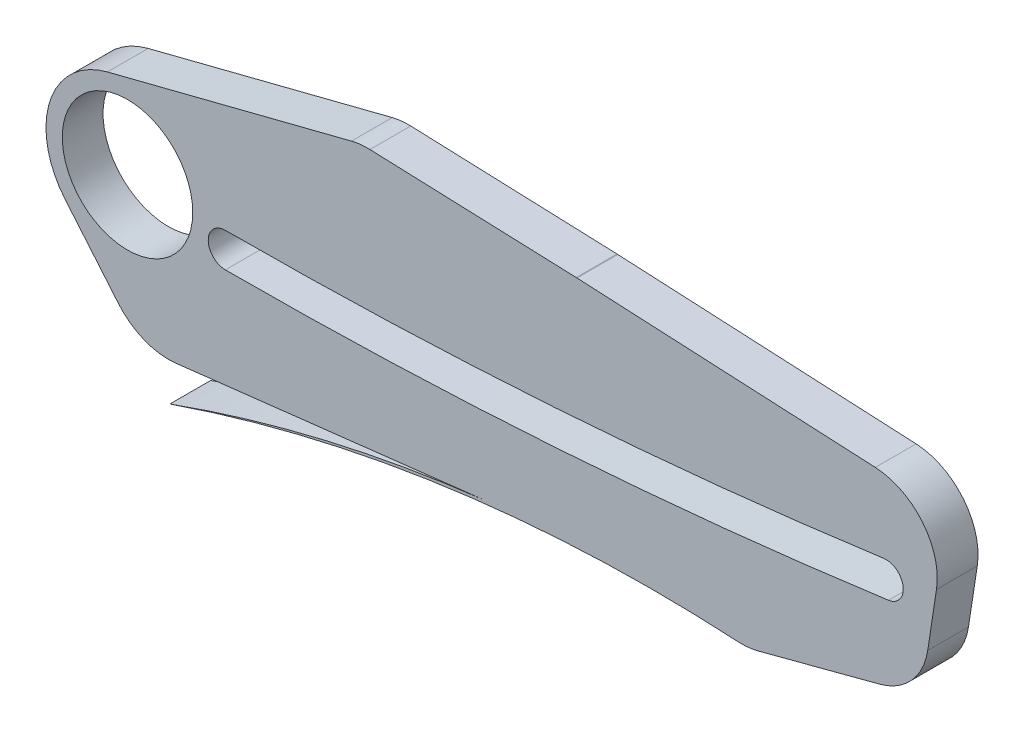
from build123d import *

# Parameters (mm, degrees)
SKETCH_1_R          = 4
EXTRUDE_1_DEPTH     = 1.25
CUT_EXTRUDE_1_DEPTH = 22
EXTRUDE_START       = -2.5
EXTRUDE_2_DEPTH     = 2.5
CUT_EXTRUDE_START   = -2.5
CUT_EXTRUDE_2_DEPTH = 2.5
CUT_EXTRUDE_4_DEPTH = 10
FILLET_1_R          = 4


with BuildPart() as part:
    # 草图1 → 凸台-拉伸1 (new, symmetric)
    with BuildSketch(Plane.XY):
        with BuildLine():
            Line((-1.233702436, 4.84540796), (14.292269552, 8.798517714))
            Line((14.292269552, 8.798517714), (27.541816671, 8.302545362))
            Line((27.541816671, 8.302545362), (50.285691672, 7.168894271))
            Line((50.285691672, 7.168894271), (48.971743891, -1.387225717))
            Line((48.971743891, -1.387225717), (38.114277377, -2.724152564))
            Line((38.114277377, -2.724152564), (18.384478153, -4.790312237))
            Line((18.384478153, -4.790312237), (3.124153733, -7.364758207))
            Line((3.124153733, -7.364758207), (-2.372822781, -4.401103504))
            ThreePointArc((-2.372822781, -4.401103504), (-4.962484216, 0.611351292), (-1.233702436, 4.84540796))
        make_face()
        Circle(SKETCH_1_R, mode=Mode.SUBTRACT)
    extrude(amount=EXTRUDE_1_DEPTH, both=True)

    # 草图2 → 切除-拉伸1 (cut)
    with BuildSketch(Plane.XY.offset(1.25)):
        with BuildLine():
            ThreePointArc((6, -2.05), (26.381158068, -1.352479883), (46.666940766, 0.736816365))
            ThreePointArc((46.666940766, 0.736816365), (47.563889378, 1.920236488), (46.380469254, 2.8171851))
            ThreePointArc((46.380469254, 2.8171851), (26.237586384, 0.742606553), (6, 0.05))
            ThreePointArc((6, 0.05), (4.95, -1), (6, -2.05))
        make_face()
    extrude(amount=-CUT_EXTRUDE_1_DEPTH, mode=Mode.SUBTRACT)

    # 草图3 → 凸台-拉伸2 (add)
    with BuildSketch(Plane(origin=(0, 0, -1.25), x_dir=(-1, 0, 0), z_dir=(0, 0, -1)).offset(EXTRUDE_START)):
        with BuildLine():
            Line((3.830222216, -3.213938048), (-2.597653881, -10.87438248))
            ThreePointArc((-2.597653881, -10.87438248), (-25.103045153, -6.203517484), (-48.061011216, -7.317703438))
            Line((-48.061011216, -7.317703438), (-48.971743891, -1.387225717))
            Line((-48.971743891, -1.387225717), (-38.114277377, -2.724152564))
            Line((-38.114277377, -2.724152564), (-18.384478153, -4.790312237))
            Line((-18.384478153, -4.790312237), (-3.124153733, -7.364758207))
            Line((-3.124153733, -7.364758207), (2.372822781, -4.401103504))
            ThreePointArc((2.372822781, -4.401103504), (3.157812892, -3.876624529), (3.830222216, -3.213938048))
        make_face()
    extrude(amount=EXTRUDE_2_DEPTH)

    # 草图4 → 切除-拉伸2 (cut)
    with BuildSketch(Plane(origin=(0, 0, -1.25), x_dir=(-1, 0, 0), z_dir=(0, 0, -1)).offset(CUT_EXTRUDE_START)):
        with BuildLine():
            Line((-48.675283939, -3.317703438), (-38.061011216, -6.114773366))
            ThreePointArc((-38.061011216, -6.114773366), (-43.07765861, -6.577848026), (-48.061011216, -7.317703438))
            Line((-48.061011216, -7.317703438), (-48.675283939, -3.317703438))
        make_face()
    extrude(amount=CUT_EXTRUDE_2_DEPTH, mode=Mode.SUBTRACT)

    # 草图6 → 切除-拉伸4 (cut)
    with BuildSketch(Plane(origin=(0, 0, -1.25), x_dir=(-1, 0, 0), z_dir=(0, 0, -1))):
        with BuildLine():
            ThreePointArc((-21.916565225, -6.331777176), (-20.02762746, -6.571548728), (-18.144467787, -6.853126294))
            ThreePointArc((-18.144467787, -6.853126294), (-10.276894061, -8.499690713), (-2.597653881, -10.87438248))
            Line((-2.597653881, -10.87438248), (-0.832664521, -8.770950068))
            Line((-0.832664521, -8.770950068), (-21.916565225, -6.331777176))
        make_face()
    extrude(amount=-CUT_EXTRUDE_4_DEPTH, mode=Mode.SUBTRACT)

    # 圆角1
    fillet_1_edges = [part.edges().sort_by_distance(p)[0] for p in [
        (14.292269552, 8.798517714, 0),
        (27.541816671, 8.302545362, 0),
        (50.285691672, 7.168894271, 0),
        (48.675283939, -3.317703438, 0),
        (38.061011216, -6.114773366, 0),
        (0.832664521, -8.770950068, 0),
    ]]
    fillet(fillet_1_edges, radius=FILLET_1_R)


solid = part.part
